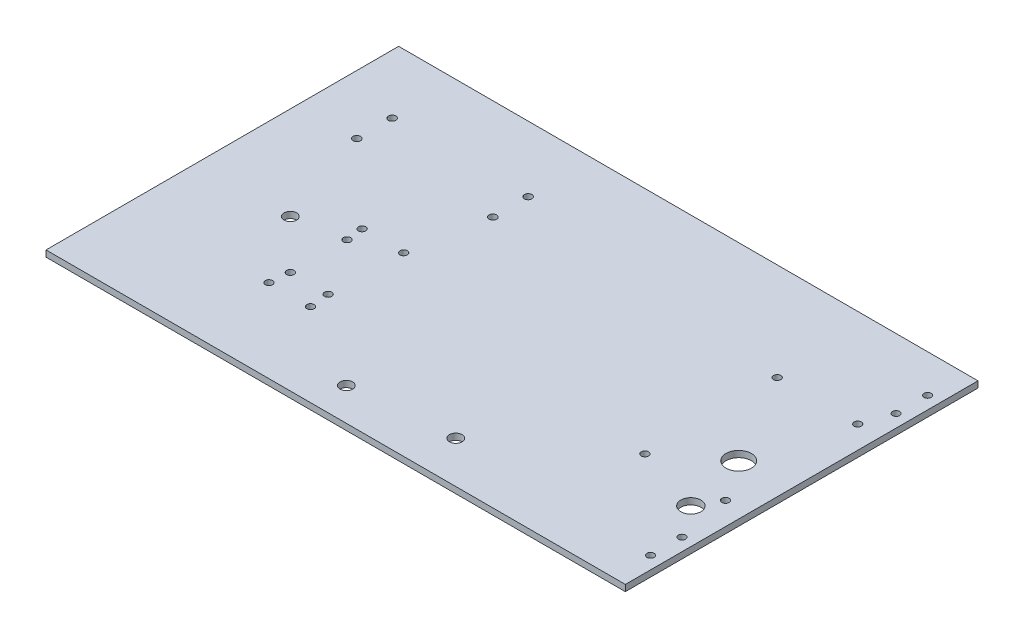
from build123d import *

# Parameters (mm, degrees)
SKETCH1_W           = 317.5
SKETCH1_H           = 177.8
SKETCH1_R           = 3.175
SKETCH1_R_2         = 6.4135
SKETCH1_R_3         = 1.905
BOSS_EXTRUDE1_DEPTH = 3.175
SKETCH3_R           = 3.175
CUT_EXTRUDE2_DEPTH  = 182.974869488
SKETCH4_W           = 25.4
SKETCH4_H           = 177.8
CUT_EXTRUDE3_DEPTH  = 182.974869488
SKETCH5_R           = 5.08
CUT_EXTRUDE4_DEPTH  = 182.974869488
SKETCH6_R           = 1.8034
CUT_EXTRUDE5_DEPTH  = 182.974869488
SKETCH7_R           = 1.8415
CUT_EXTRUDE6_DEPTH  = 182.974869488


with BuildPart() as part:
    # Sketch1 → Boss-Extrude1 (new body)
    with BuildSketch(Plane(origin=(0, 0, 0), x_dir=(1, 0, 0), z_dir=(0, 1, 0))):
        Rectangle(SKETCH1_W, SKETCH1_H)
        with Locations(Location((-111.76, -12.7, 0), (0, 0, 270))):
            Circle(SKETCH1_R, mode=Mode.SUBTRACT)
        with Locations(Location((107.95, -6.35, 0), (0, 0, 270))):
            Circle(SKETCH1_R_2, mode=Mode.SUBTRACT)
        with Locations(Location((-129.032, 55.88, 0), (0, 0, 270))):
            Circle(SKETCH1_R_3, mode=Mode.SUBTRACT)
        with Locations(Location((-60.452, 55.88, 0), (0, 0, 270))):
            Circle(SKETCH1_R_3, mode=Mode.SUBTRACT)
        with Locations(Location((-129.032, 38.1, 0), (0, 0, 270))):
            Circle(SKETCH1_R_3, mode=Mode.SUBTRACT)
        with Locations(Location((-60.452, 38.1, 0), (0, 0, 270))):
            Circle(SKETCH1_R_3, mode=Mode.SUBTRACT)
    extrude(amount=BOSS_EXTRUDE1_DEPTH)

    # Sketch3 → Cut-Extrude2 (cut, through all)
    with BuildSketch(Plane(origin=(0, 0, 0), x_dir=(-1, 0, 0), z_dir=(0, -1, 0))):
        with Locations(Location((23.829539609, -72.39, 0), (0, 0, 90))):
            Circle(SKETCH3_R)
        with Locations(Location((-26.764302072, -67.818, 0), (0, 0, 90))):
            Circle(SKETCH3_R)
    extrude(amount=-CUT_EXTRUDE2_DEPTH, mode=Mode.SUBTRACT)

    # Sketch4 → Cut-Extrude3 (cut, through all)
    with BuildSketch(Plane(origin=(0, 3.175, 0), x_dir=(1, 0, 0), z_dir=(0, 1, 0))):
        with Locations((146.05, 0)):
            Rectangle(SKETCH4_W, SKETCH4_H)
    extrude(amount=-CUT_EXTRUDE3_DEPTH, mode=Mode.SUBTRACT)

    # Sketch5 → Cut-Extrude4 (cut, through all)
    with BuildSketch(Plane(origin=(0, 3.175, 0), x_dir=(1, 0, 0), z_dir=(0, 1, 0))):
        with Locations(Location((115.57, -38.1, 0), (0, 0, 270))):
            Circle(SKETCH5_R)
    extrude(amount=-CUT_EXTRUDE4_DEPTH, mode=Mode.SUBTRACT)

    # Sketch6 → Cut-Extrude5 (cut, through all)
    with BuildSketch(Plane.XZ):
        with Locations(Location((127, 69.85, 0), (0, 0, 270))):
            Circle(SKETCH6_R)
        with Locations(Location((127, 53.975, 0), (0, 0, 270))):
            Circle(SKETCH6_R)
        with Locations(Location((127, -53.975, 0), (0, 0, 270))):
            Circle(SKETCH6_R)
        with Locations(Location((127, -69.85, 0), (0, 0, 270))):
            Circle(SKETCH6_R)
    extrude(amount=-CUT_EXTRUDE5_DEPTH, mode=Mode.SUBTRACT)

    # Sketch7 → Cut-Extrude6 (cut, through all)
    with BuildSketch(Plane(origin=(0, 3.175, 0), x_dir=(1, 0, 0), z_dir=(0, 1, 0))):
        with Locations(Location((121.92, 39.6875, 0), (0, 0, 270))):
            Circle(SKETCH7_R)
        with Locations(Location((81.28, 39.6875, 0), (0, 0, 270))):
            Circle(SKETCH7_R)
        with Locations(Location((81.28, -26.9875, 0), (0, 0, 270))):
            Circle(SKETCH7_R)
        with Locations(Location((121.92, -26.9875, 0), (0, 0, 270))):
            Circle(SKETCH7_R)
        with Locations(Location((-88.265, -46.99, 0), (0, 0, 270))):
            Circle(SKETCH7_R)
        with Locations(Location((-67.31, -46.99, 0), (0, 0, 270))):
            Circle(SKETCH7_R)
        with Locations(Location((-87.3125, -37.1475, 0), (0, 0, 270))):
            Circle(SKETCH7_R)
        with Locations(Location((-68.2625, -37.1475, 0), (0, 0, 270))):
            Circle(SKETCH7_R)
        with Locations(Location((-87.3125, -8.5725, 0), (0, 0, 270))):
            Circle(SKETCH7_R)
        with Locations(Location((-88.265, 0, 0), (0, 0, 270))):
            Circle(SKETCH7_R)
        with Locations(Location((-67.31, 0, 0), (0, 0, 270))):
            Circle(SKETCH7_R)
    extrude(amount=-CUT_EXTRUDE6_DEPTH, mode=Mode.SUBTRACT)


solid = part.part
